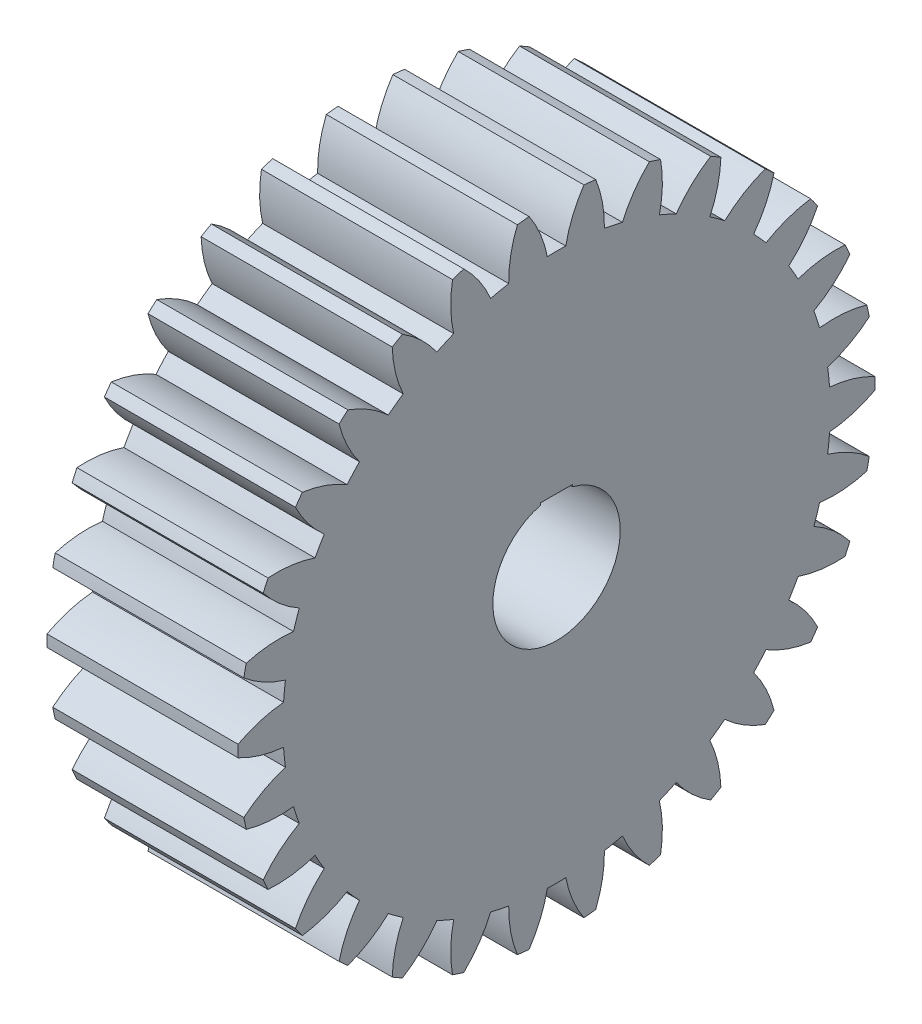
from build123d import *

# Parameters (mm, degrees)
BASPROSKE_W         = 12
BASPROSKE_H         = 20
TOOTHCUT_DEPTH      = 31.724582991
TEETHCUTS_COUNT     = 30
TEETHCUTS_ANGLE     = 348
HUBNEAONESKE_R      = 5
HUBNEARONE_DEPTH    = 5.0000508
BORSKE_R            = 3
BORE_DEPTH          = 12.0000508
KEYSKE_W            = 2
KEYSKE_H            = 4
KEYWAY_DEPTH        = 12.0000508
SKETCH1_R           = 1.45
CUT_EXTRUDE1_DEPTH  = 10
SKETCH2_R           = 4
CUT_EXTRUDE2_DEPTH  = 20
SKETCH3_R           = 7
SKETCH3_R_2         = 5
BOSS_EXTRUDE1_DEPTH = 5
SKETCH4_R           = 1.4
CUT_EXTRUDE3_DEPTH  = 15


with BuildPart() as part:
    # BasProSke → Base-Revolve (revolve)
    with BuildSketch(Plane(origin=(0, 0, 0), x_dir=(1, 0, 0), z_dir=(0, 1, 0)), mode=Mode.PRIVATE) as base_revolve_sk:
        with Locations((6, 10)):
            Rectangle(BASPROSKE_W, BASPROSKE_H)
    revolve(base_revolve_sk.sketch.rotate(Axis((-10, 0, 0), (1, 0, 0)), 180), axis=Axis((-10, 0, 0), (1, 0, 0)))

    # TooCutSke → ToothCut (cut, through all)
    with BuildSketch(Plane(origin=(0, 0, 0), x_dir=(0, 0, -1), z_dir=(1, 0, 0))):
        with BuildLine():
            ThreePointArc((0.579037291, 17.176742941), (0, 17.1865), (-0.579037291, 17.176742941))
            ThreePointArc((-0.579037291, 17.176742941), (-1.018221033, 18.621940754), (-1.73807329, 19.949830736))
            ThreePointArc((-1.73807329, 19.949830736), (0, 20.0254), (1.73807329, 19.949830736))
            ThreePointArc((1.73807329, 19.949830736), (1.018221033, 18.621940754), (0.579037291, 17.176742941))
        make_face()
    toothcut = extrude(amount=TOOTHCUT_DEPTH, mode=Mode.SUBTRACT)

    # TeethCuts: ToothCut ×30 about axis
    teethcuts_axis = Axis((-10, 0, 0), (1, 0, 0))
    for i in range(1, TEETHCUTS_COUNT):
        add(toothcut.rotate(teethcuts_axis, i * TEETHCUTS_ANGLE / (TEETHCUTS_COUNT - 1)), mode=Mode.SUBTRACT)

    # HubNeaOneSke → HubNearOne (add)
    with BuildSketch(Plane.ZY):
        with Locations(Location((0, 0, 0), (0, 0, 180))):
            Circle(HUBNEAONESKE_R)
    extrude(amount=HUBNEARONE_DEPTH)

    # BorSke → Bore (cut, symmetric)
    with BuildSketch(Plane(origin=(0, 0, 0), x_dir=(0, 0, -1), z_dir=(1, 0, 0))):
        with Locations(Location((0, 0, 0), (0, 0, 180))):
            Circle(BORSKE_R)
    extrude(amount=BORE_DEPTH, both=True, mode=Mode.SUBTRACT)

    # KeySke → Keyway (cut, symmetric)
    with BuildSketch(Plane(origin=(0, 0, 0), x_dir=(0, 0, -1), z_dir=(1, 0, 0))):
        with Locations((0, 2)):
            Rectangle(KEYSKE_W, KEYSKE_H)
    extrude(amount=KEYWAY_DEPTH, both=True, mode=Mode.SUBTRACT)

    # Sketch1 → Cut-Extrude1 (cut)
    with BuildSketch(Plane.XZ.offset(-4)):
        with Locations(Location((-2.5000254, 0, 0), (0, 0, 270))):
            Circle(SKETCH1_R)
    extrude(amount=-CUT_EXTRUDE1_DEPTH, mode=Mode.SUBTRACT)

    # Sketch2 → Cut-Extrude2 (cut)
    with BuildSketch(Plane.ZY.offset(5.0000508)):
        Circle(SKETCH2_R)
    extrude(amount=-CUT_EXTRUDE2_DEPTH, mode=Mode.SUBTRACT)

    # Sketch3 → Boss-Extrude1 (add)
    with BuildSketch(Plane.ZY):
        with Locations(Location((0, 0, 0), (0, 0, 180))):
            Circle(SKETCH3_R)
        Circle(SKETCH3_R_2, mode=Mode.SUBTRACT)
    extrude(amount=BOSS_EXTRUDE1_DEPTH)

    # Sketch4 → Cut-Extrude3 (cut)
    with BuildSketch(Plane(origin=(0, 0, 0), x_dir=(1, 0, 0), z_dir=(0, 1, 0))):
        with Locations(Location((-2.5, 0, 0), (0, 0, 90))):
            Circle(SKETCH4_R)
    extrude(amount=CUT_EXTRUDE3_DEPTH, mode=Mode.SUBTRACT)


solid = part.part
